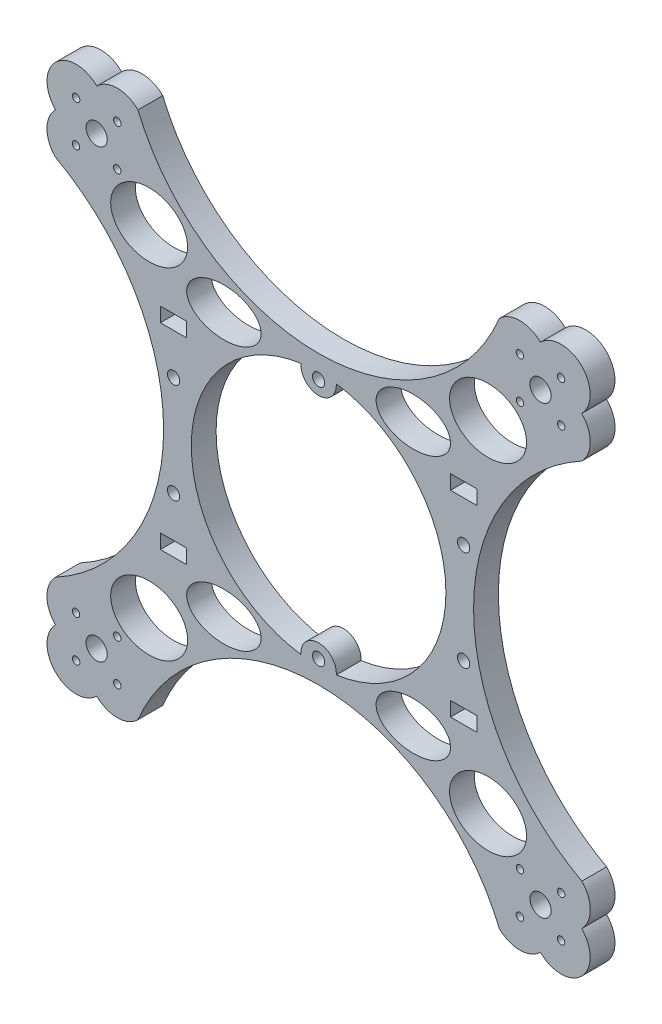
from build123d import *

# Parameters (mm, degrees)
SKETCH1_R           = 1.449927
SKETCH1_R_2         = 1.449937953
SKETCH1_R_3         = 0.874912417
SKETCH1_R_4         = 2.499893062
SKETCH1_RX          = 9.072899251
SKETCH1_RY          = 7.568087766
SKETCH1_RX_2        = 8.777378771
SKETCH1_RY_2        = 5.601336902
SKETCH1_W           = 6.19999
SKETCH1_H           = 3.400011
BOSS_EXTRUDE3_DEPTH = 5.85


with BuildPart() as part:
    # Sketch1 → Boss-Extrude3 (new body)
    with BuildSketch(Plane.XY):
        with BuildLine():
            ThreePointArc((586.387462743, 493.254803119), (611.911693149, 450.352706702), (586.387462742, 407.450610286))
            ThreePointArc((586.387462742, 407.450610286), (584.387859448, 402.590740006), (586.410373629, 397.740359727))
            ThreePointArc((586.410373629, 397.740359727), (586.433284516, 388.030109168), (596.143535075, 388.053020055))
            ThreePointArc((596.143535075, 388.053020055), (601.003405354, 386.053416761), (605.853785634, 388.075930942))
            ThreePointArc((605.853785634, 388.075930942), (648.462479749, 416.506624656), (691.071173865, 388.075930942))
            ThreePointArc((691.071173865, 388.075930942), (695.921554144, 386.053416761), (700.781424424, 388.053020055))
            ThreePointArc((700.781424424, 388.053020055), (710.491674982, 388.030109168), (710.514585869, 397.740359727))
            ThreePointArc((710.514585869, 397.740359727), (712.53710005, 402.590740006), (710.537496756, 407.450610285))
            ThreePointArc((710.537496756, 407.450610285), (685.01326635, 450.352706702), (710.537496756, 493.254803119))
            ThreePointArc((710.537496756, 493.254803119), (712.53710005, 498.114673398), (710.514585869, 502.965053678))
            ThreePointArc((710.514585869, 502.965053678), (710.491674982, 512.675304236), (700.781424424, 512.652393349))
            ThreePointArc((700.781424424, 512.652393349), (695.921554144, 514.651996644), (691.071173865, 512.629482462))
            ThreePointArc((691.071173865, 512.629482462), (648.462479749, 484.198788748), (605.853785634, 512.629482462))
            ThreePointArc((605.853785634, 512.629482462), (601.003405354, 514.651996644), (596.143535075, 512.652393349))
            ThreePointArc((596.143535075, 512.652393349), (586.433284516, 512.675304236), (586.41037363, 502.965053678))
            ThreePointArc((586.41037363, 502.965053678), (584.387859448, 498.114673398), (586.387462743, 493.254803119))
        make_face()
        with Locations((648.462479749, 478.880494)):
            Circle(SKETCH1_R, mode=Mode.SUBTRACT)
        with Locations((682.660917541, 462.166264459)):
            Circle(SKETCH1_R_2, mode=Mode.SUBTRACT)
        with Locations((600.964294024, 498.075562068)):
            Circle(SKETCH1_R_3, mode=Mode.SUBTRACT)
        with Locations((591.254043465, 498.098472955)):
            Circle(SKETCH1_R_3, mode=Mode.SUBTRACT)
        with Locations((591.276954352, 507.808723514)):
            Circle(SKETCH1_R_3, mode=Mode.SUBTRACT)
        with Locations((600.987204911, 507.785812627)):
            Circle(SKETCH1_R_3, mode=Mode.SUBTRACT)
        with Locations((596.120624188, 502.942142791)):
            Circle(SKETCH1_R_4, mode=Mode.SUBTRACT)
        with Locations((700.804335311, 502.942142791)):
            Circle(SKETCH1_R_4, mode=Mode.SUBTRACT)
        with Locations((695.937754588, 507.785812627)):
            Circle(SKETCH1_R_3, mode=Mode.SUBTRACT)
        with Locations((705.648005146, 507.808723514)):
            Circle(SKETCH1_R_3, mode=Mode.SUBTRACT)
        with Locations((705.670916033, 498.098472955)):
            Circle(SKETCH1_R_3, mode=Mode.SUBTRACT)
        with Locations((695.960665475, 498.075562068)):
            Circle(SKETCH1_R_3, mode=Mode.SUBTRACT)
        with Locations((614.264041957, 462.166264459)):
            Circle(SKETCH1_R_2, mode=Mode.SUBTRACT)
        with Locations((614.264041957, 438.539148946)):
            Circle(SKETCH1_R_2, mode=Mode.SUBTRACT)
        with Locations((695.960665475, 402.629851336)):
            Circle(SKETCH1_R_3, mode=Mode.SUBTRACT)
        with Locations((705.670916033, 402.606940449)):
            Circle(SKETCH1_R_3, mode=Mode.SUBTRACT)
        with Locations((705.648005146, 392.896689891)):
            Circle(SKETCH1_R_3, mode=Mode.SUBTRACT)
        with Locations((695.937754588, 392.919600778)):
            Circle(SKETCH1_R_3, mode=Mode.SUBTRACT)
        with Locations((700.804335311, 397.763270613)):
            Circle(SKETCH1_R_4, mode=Mode.SUBTRACT)
        with Locations((596.120624188, 397.763270613)):
            Circle(SKETCH1_R_4, mode=Mode.SUBTRACT)
        with Locations((600.987204911, 392.919600778)):
            Circle(SKETCH1_R_3, mode=Mode.SUBTRACT)
        with Locations((591.276954352, 392.896689891)):
            Circle(SKETCH1_R_3, mode=Mode.SUBTRACT)
        with Locations((591.254043465, 402.606940449)):
            Circle(SKETCH1_R_3, mode=Mode.SUBTRACT)
        with Locations((600.964294024, 402.629851336)):
            Circle(SKETCH1_R_3, mode=Mode.SUBTRACT)
        with Locations((682.660917541, 438.539148946)):
            Circle(SKETCH1_R_2, mode=Mode.SUBTRACT)
        with Locations((648.462479749, 421.824919404)):
            Circle(SKETCH1_R, mode=Mode.SUBTRACT)
        with Locations((608.496752749, 490.507474302)):
            Ellipse(SKETCH1_RX, SKETCH1_RY, mode=Mode.SUBTRACT)
        with Locations(Location((670.798820229, 481.426311828), (0, 0, 180))):
            Ellipse(SKETCH1_RX_2, SKETCH1_RY_2, mode=Mode.SUBTRACT)
        with Locations(Location((688.428206749, 490.507474302), (0, 0, 180))):
            Ellipse(SKETCH1_RX, SKETCH1_RY, mode=Mode.SUBTRACT)
        with Locations((626.12613927, 481.426311828)):
            Ellipse(SKETCH1_RX_2, SKETCH1_RY_2, mode=Mode.SUBTRACT)
        with Locations((626.12613927, 419.279101576)):
            Ellipse(SKETCH1_RX_2, SKETCH1_RY_2, mode=Mode.SUBTRACT)
        with Locations(Location((688.428206749, 410.197939102), (0, 0, 180))):
            Ellipse(SKETCH1_RX, SKETCH1_RY, mode=Mode.SUBTRACT)
        with Locations(Location((670.798820229, 419.279101576), (0, 0, 180))):
            Ellipse(SKETCH1_RX_2, SKETCH1_RY_2, mode=Mode.SUBTRACT)
        with Locations((608.496752749, 410.197939102)):
            Ellipse(SKETCH1_RX, SKETCH1_RY, mode=Mode.SUBTRACT)
        with Locations((614.248765499, 473.5132475)):
            Rectangle(SKETCH1_W, SKETCH1_H, mode=Mode.SUBTRACT)
        with Locations((682.676194, 473.5132475)):
            Rectangle(SKETCH1_W, SKETCH1_H, mode=Mode.SUBTRACT)
        with Locations((682.676194, 427.192165904)):
            Rectangle(SKETCH1_W, SKETCH1_H, mode=Mode.SUBTRACT)
        with Locations((614.248765499, 427.192165904)):
            Rectangle(SKETCH1_W, SKETCH1_H, mode=Mode.SUBTRACT)
        with BuildLine():
            ThreePointArc((652.62969556, 480.08666297), (671.118523525, 470.054927983), (678.48703375, 450.352706702))
            ThreePointArc((678.48703375, 450.352706702), (671.118523525, 430.650485421), (652.62969556, 420.618750434))
            ThreePointArc((652.62969556, 420.618750434), (651.520237389, 423.763672389), (648.462479749, 425.094668164))
            ThreePointArc((648.462479749, 425.094668164), (645.40472211, 423.763672389), (644.295263939, 420.618750434))
            ThreePointArc((644.295263939, 420.618750434), (625.806435974, 430.650485421), (618.437925749, 450.352706702))
            ThreePointArc((618.437925749, 450.352706702), (625.806435974, 470.054927983), (644.295263939, 480.08666297))
            ThreePointArc((644.295263939, 480.08666297), (645.40472211, 476.941741015), (648.462479749, 475.610745241))
            ThreePointArc((648.462479749, 475.610745241), (651.520237389, 476.941741015), (652.62969556, 480.08666297))
        make_face(mode=Mode.SUBTRACT)
    extrude(amount=BOSS_EXTRUDE3_DEPTH)


solid = part.part
